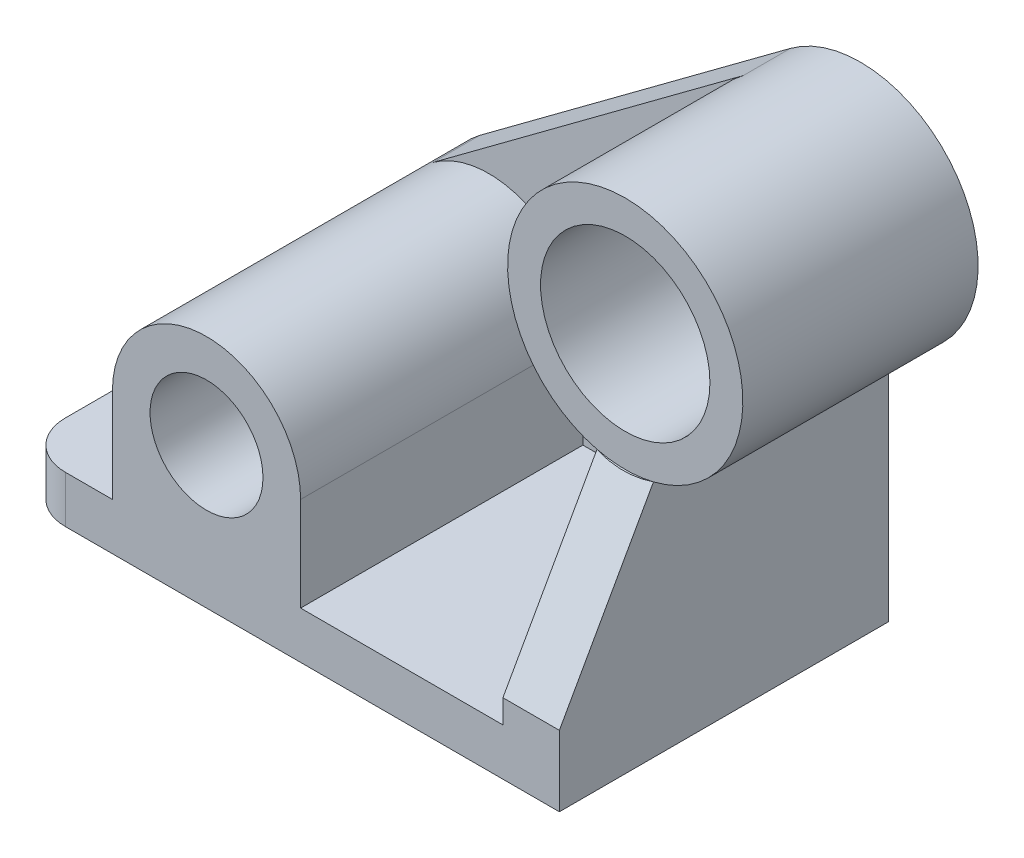
from build123d import *

# Parameters (mm, degrees)
SKETCH2_R           = 12
SKETCH2_R_2         = 18
BOSS_EXTRUDE2_DEPTH = 35
BOSS_EXTRUDE5_START = 10
BOSS_EXTRUDE5_DEPTH = 10
FILLET2_R           = 10
SKETCH4_R           = 18
CUT_EXTRUDE1_DEPTH  = 20
CUT_EXTRUDE4_DEPTH  = 20


with BuildPart() as part:
    # Sketch2 → Boss-Extrude2 (new, symmetric)
    with BuildSketch(Plane.XY):
        with BuildLine():
            Line((47.053173242, -26.424193548), (47.053173242, 24.306484253))
            ThreePointArc((47.053173242, 24.306484253), (41.053173242, 73.575806452), (35.053173242, 24.306484253))
            Line((35.053173242, 24.306484253), (35.053173242, -16.424193548))
            Line((35.053173242, -16.424193548), (-7.946826758, -16.424193548))
            Line((-7.946826758, -16.424193548), (-7.946826758, 3.575806452))
            ThreePointArc((-7.946826758, 3.575806452), (-27.946826758, 23.575806452), (-47.946826758, 3.575806452))
            Line((-47.946826758, 3.575806452), (-47.946826758, -16.424193548))
            Line((-47.946826758, -16.424193548), (-67.946826758, -16.424193548))
            Line((-67.946826758, -16.424193548), (-67.946826758, -26.424193548))
            Line((-67.946826758, -26.424193548), (47.053173242, -26.424193548))
        make_face()
        with Locations((-27.946826758, 3.575806452)):
            Circle(SKETCH2_R, mode=Mode.SUBTRACT)
        with Locations((41.053173242, 48.575806452)):
            Circle(SKETCH2_R_2, mode=Mode.SUBTRACT)
    extrude(amount=BOSS_EXTRUDE2_DEPTH, both=True)

    # Sketch3 → Boss-Extrude5 (add)
    with BuildSketch(Plane.XY.offset(-35).offset(BOSS_EXTRUDE5_START)):
        with BuildLine():
            ThreePointArc((35.053173242, 24.306484253), (16.542288051, 43.654779406), (26.150658834, 68.648550766))
            Line((26.150658834, 68.648550766), (-39.868838285, 19.634001903))
            ThreePointArc((-39.868838285, 19.634001903), (-18.959063703, 21.442538533), (-7.946826758, 3.575806452))
            Line((-7.946826758, 3.575806452), (-7.946826758, -16.424193548))
            Line((-7.946826758, -16.424193548), (35.053173242, -16.424193548))
            Line((35.053173242, -16.424193548), (35.053173242, 24.306484253))
        make_face()
    extrude(amount=-BOSS_EXTRUDE5_DEPTH)

    # Fillet2
    fillet2_edges = [part.edges().sort_by_distance(p)[0] for p in [
        (-67.946826758, -21.424193548, 35),
    ]]
    fillet(fillet2_edges, radius=FILLET2_R)

    # Sketch4 → Cut-Extrude1 (cut)
    with BuildSketch(Plane.XY.offset(35)):
        with BuildLine():
            ThreePointArc((35.053173242, 24.306484253), (41.053173242, 23.575806452), (47.053173242, 24.306484253))
            ThreePointArc((47.053173242, 24.306484253), (60.738192927, 33.164771444), (66.053173242, 48.575806452))
            ThreePointArc((66.053173242, 48.575806452), (25.642138234, 68.260826137), (35.053173242, 24.306484253))
        make_face()
        with Locations((41.053173242, 48.575806452)):
            Circle(SKETCH4_R, mode=Mode.SUBTRACT)
    extrude(amount=-CUT_EXTRUDE1_DEPTH, mode=Mode.SUBTRACT)

    # Sketch5 → Cut-Extrude4 (cut)
    with BuildSketch(Plane(origin=(47.053173242, 0, 0), x_dir=(0, 0, -1), z_dir=(1, 0, 0))):
        Polygon((-35, 24.306484253), (-35, -11.424193548), (-15, 24.306484253), align=None)
    extrude(amount=-CUT_EXTRUDE4_DEPTH, mode=Mode.SUBTRACT)


solid = part.part
